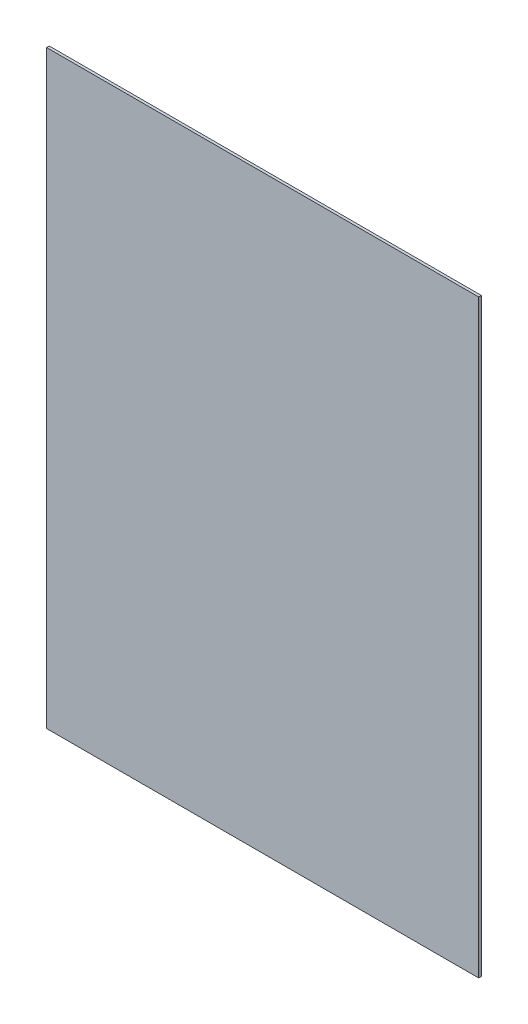
from build123d import *

# Parameters (mm, degrees)
SKETCH2_W           = 330
SKETCH2_H           = 450.48
BOSS_EXTRUDE1_DEPTH = 2.032


with BuildPart() as part:
    # Sketch2 → Boss-Extrude1 (new body)
    with BuildSketch(Plane.XY):
        Rectangle(SKETCH2_W, SKETCH2_H)
    extrude(amount=BOSS_EXTRUDE1_DEPTH)


solid = part.part
